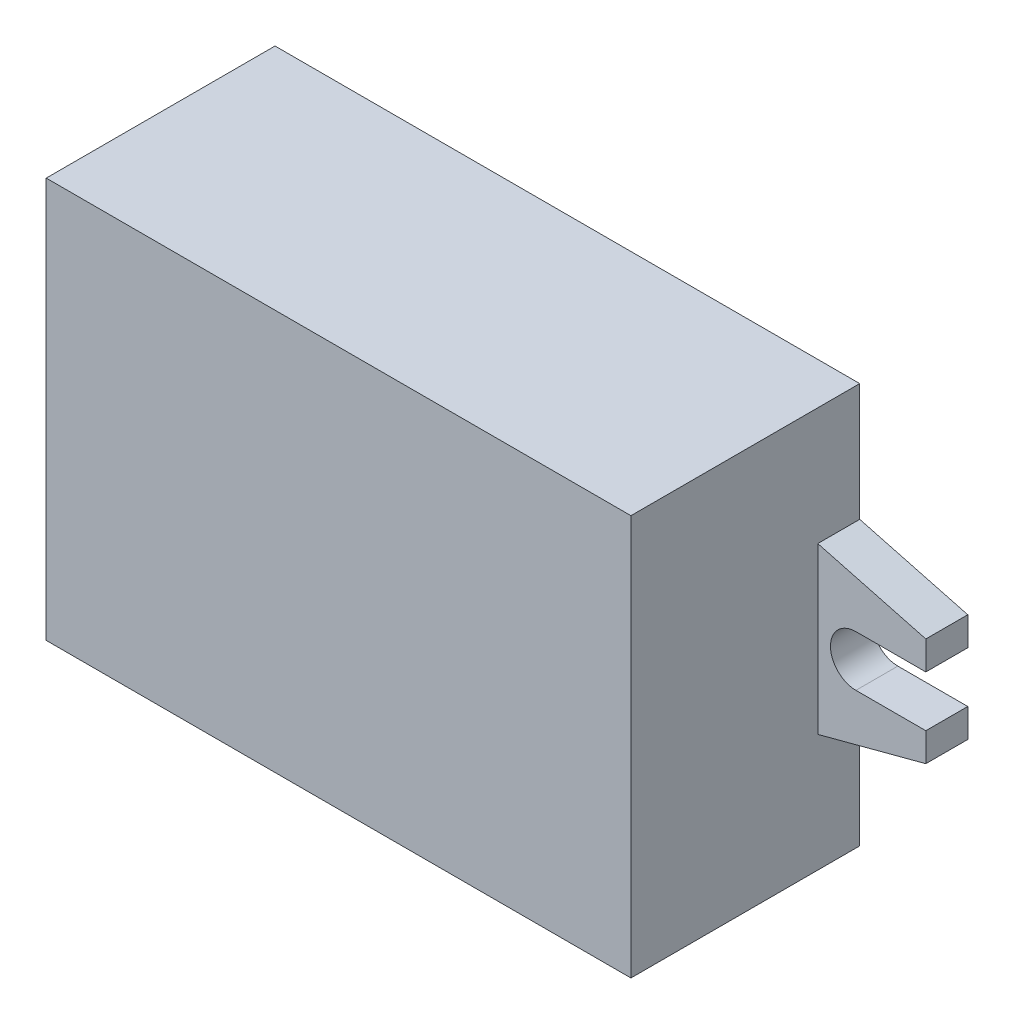
from build123d import *

# Parameters (mm, degrees)
SKETCH_1_W          = 46
SKETCH_1_H          = 31.5
EXTRUDE_1_DEPTH     = 18
SKETCH_3_W          = 3.3
SKETCH_3_H          = 13
EXTRUDE_2_DEPTH     = 8.5
SKETCH_4_W          = 3.3
SKETCH_4_H          = 13
EXTRUDE_3_DEPTH     = 8.5
CUT_EXTRUDE_1_DEPTH = 65.642014201
CUT_EXTRUDE_2_DEPTH = 65.642014201


with BuildPart() as part:
    # 草图1 → 凸台-拉伸1 (new body)
    with BuildSketch(Plane.XY):
        with Locations((23, 15.75)):
            Rectangle(SKETCH_1_W, SKETCH_1_H)
    extrude(amount=EXTRUDE_1_DEPTH)

    # 草图3 → 凸台-拉伸2 (add)
    with BuildSketch(Plane.ZY):
        with Locations((1.65, 15.75)):
            Rectangle(SKETCH_3_W, SKETCH_3_H)
    extrude(amount=EXTRUDE_2_DEPTH)

    # 草图4 → 凸台-拉伸3 (add)
    with BuildSketch(Plane(origin=(46, 0, 0), x_dir=(0, 0, -1), z_dir=(1, 0, 0))):
        with Locations((-1.65, 15.75)):
            Rectangle(SKETCH_4_W, SKETCH_4_H)
    extrude(amount=EXTRUDE_3_DEPTH)

    # 草图5 → 切除-拉伸1 (cut, through all)
    with BuildSketch(Plane.XY.offset(3.3)):
        Polygon((-8.5, 22.25), (-8.5, 20), (0, 22.25), align=None)
        Polygon((-8.5, 11.5), (0, 9.25), (-8.5, 9.25), align=None)
        with BuildLine():
            Line((-3, 17.75), (-8.5, 17.75))
            Line((-8.5, 17.75), (-8.5, 13.75))
            Line((-8.5, 13.75), (-3, 13.75))
            ThreePointArc((-3, 13.75), (-1, 15.75), (-3, 17.75))
        make_face()
    extrude(amount=-CUT_EXTRUDE_1_DEPTH, mode=Mode.SUBTRACT)

    # 草图6 → 切除-拉伸2 (cut, through all)
    with BuildSketch(Plane.XY.offset(3.3)):
        Polygon((46, 22.25), (54.5, 20), (54.5, 22.25), align=None)
        Polygon((46, 9.25), (54.5, 9.25), (54.5, 11.5), align=None)
        with BuildLine():
            Line((49, 17.75), (54.5, 17.75))
            Line((54.5, 17.75), (54.5, 13.75))
            Line((54.5, 13.75), (49, 13.75))
            ThreePointArc((49, 13.75), (47, 15.75), (49, 17.75))
        make_face()
    extrude(amount=-CUT_EXTRUDE_2_DEPTH, mode=Mode.SUBTRACT)


solid = part.part
